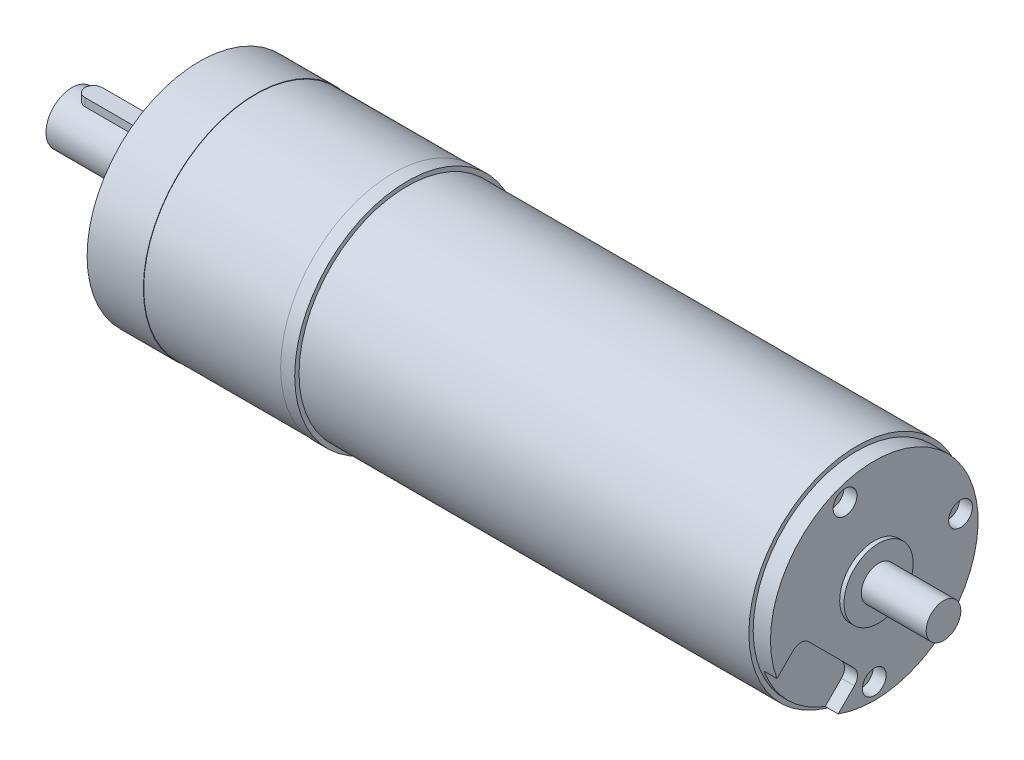
from build123d import *

# Parameters (mm, degrees)
BOSS_EXTRUDE1_DEPTH             = 1.5
BOSS_EXTRUDE1_DEPTH_BACK        = 1.5
SKETCH4_R                       = 3
CUT_EXTRUDE1_DEPTH              = 3.5
TAP_DRILL_FOR_M4X0_7_TAP1_D     = 3.3
TAP_DRILL_FOR_M4X0_7_TAP1_DEPTH = 10
TAP_DRILL_FOR_M4X0_7_TAP1_TIP   = 0.991420021
TAP_DRILL_FOR_M5X0_8_TAP1_D     = 4.2
TAP_DRILL_FOR_M5X0_8_TAP1_DEPTH = 10
TAP_DRILL_FOR_M5X0_8_TAP1_TIP   = 1.2618073
CUT_EXTRUDE2_DEPTH              = 3
FILLET1_R                       = 2.5
SKETCH12_R                      = 2.75
CUT_EXTRUDE3_DEPTH              = 3
TAP_DRILL_FOR_M3X0_5_TAP2_D     = 2.5
TAP_DRILL_FOR_M3X0_5_TAP2_DEPTH = 10
TAP_DRILL_FOR_M3X0_5_TAP2_TIP   = 0.751075774


with BuildPart() as part:
    # Sketch2 → Revolve1 (revolve)
    with BuildSketch(Plane(origin=(0, 0, 0), x_dir=(1, 0, 0), z_dir=(0, 1, 0))):
        Polygon((-77.5, 0), (-77.5, 6), (-51.5, 6), (-51.5, 16), (-48, 16), (-48, 26), (-35, 26), (-35, 25.9), (-3.25, 25.9), (-3.25, 26), (0, 26), (0, 25), (104, 25), (104, 24), (108, 24), (108, 8), (109, 8), (109, 4), (124, 4), (124, 0), align=None)
    revolve(axis=Axis((-131.1939937, 0, 0), (1, 0, 0)))

    # Sketch3 → Boss-Extrude1 (add, two sides: drawn at the far end of the back side and taken through both)
    with BuildSketch(Plane(origin=(0, 6, 0), x_dir=(1, 0, 0), z_dir=(0, 1, 0)).offset(-BOSS_EXTRUDE1_DEPTH_BACK)):
        with BuildLine():
            Line((-56.5, 2), (-72.5, 2))
            ThreePointArc((-72.5, 2), (-74.5, 0), (-72.5, -2))
            Line((-72.5, -2), (-56.5, -2))
            ThreePointArc((-56.5, -2), (-54.5, 0), (-56.5, 2))
        make_face()
    extrude(amount=BOSS_EXTRUDE1_DEPTH + BOSS_EXTRUDE1_DEPTH_BACK)

    # Sketch4 → Cut-Extrude1 (cut)
    with BuildSketch(Plane.ZY.offset(77.5)):
        Circle(SKETCH4_R)
    extrude(amount=-CUT_EXTRUDE1_DEPTH, mode=Mode.SUBTRACT)

    # Tap Drill for M4x0.7 Tap1
    with Locations(Plane.ZY.offset(74)):
        with Locations((0, 0)):
            Hole(TAP_DRILL_FOR_M4X0_7_TAP1_D / 2, depth=TAP_DRILL_FOR_M4X0_7_TAP1_DEPTH)
            with Locations((0, 0, -(TAP_DRILL_FOR_M4X0_7_TAP1_DEPTH + TAP_DRILL_FOR_M4X0_7_TAP1_TIP / 2))):  # 118° drill point
                Cone(0, TAP_DRILL_FOR_M4X0_7_TAP1_D / 2, TAP_DRILL_FOR_M4X0_7_TAP1_TIP, mode=Mode.SUBTRACT)

    # Tap Drill for M5x0.8 Tap1
    with Locations(Plane.ZY.offset(48)):
        with Locations((0, 22.5), (14.142135624, 14.142135624), (22.5, 0), (14.142135624, -14.142135624), (0, -22.5), (-14.142135624, -14.142135624), (-22.5, 0), (-14.142135624, 14.142135624)):
            Hole(TAP_DRILL_FOR_M5X0_8_TAP1_D / 2, depth=TAP_DRILL_FOR_M5X0_8_TAP1_DEPTH)
            with Locations((0, 0, -(TAP_DRILL_FOR_M5X0_8_TAP1_DEPTH + TAP_DRILL_FOR_M5X0_8_TAP1_TIP / 2))):  # 118° drill point
                Cone(0, TAP_DRILL_FOR_M5X0_8_TAP1_D / 2, TAP_DRILL_FOR_M5X0_8_TAP1_TIP, mode=Mode.SUBTRACT)

    # Sketch13 → Cut-Extrude2 (cut)
    with BuildSketch(Plane(origin=(108, 0, 0), x_dir=(0, 0, -1), z_dir=(1, 0, 0))):
        Polygon((-16.970562748, -2.828427125), (-25.455844123, -11.313708499), (-11.313708499, -25.455844123), (-2.828427125, -16.970562748), align=None)
    extrude(amount=-CUT_EXTRUDE2_DEPTH, mode=Mode.SUBTRACT)

    # Fillet1
    fillet1_edges = [part.edges().sort_by_distance(p)[0] for p in [
        (106.5, -16.970562748, 2.828427125),
        (106.5, -2.828427125, 16.970562748),
    ]]
    fillet(fillet1_edges, radius=FILLET1_R)

    # Sketch12 → Cut-Extrude3 (cut)
    with BuildSketch(Plane(origin=(108, 0, 0), x_dir=(0, 0, -1), z_dir=(1, 0, 0))):
        with Locations((-6.759588899, 19.088490195)):
            Circle(SKETCH12_R)
        with Locations((19.957510196, 3.429327453)):
            Circle(SKETCH12_R)
        with Locations((0, -20.25)):
            Circle(SKETCH12_R)
    extrude(amount=-CUT_EXTRUDE3_DEPTH, mode=Mode.SUBTRACT)

    # Tap Drill for M3x0.5 Tap2
    with Locations(Plane(origin=(105, 0, 0), x_dir=(0, 0, -1), z_dir=(1, 0, 0))):
        with Locations((-6.759588899, 19.088490195), (19.957510196, 3.429327453), (0, -20.25)):
            Hole(TAP_DRILL_FOR_M3X0_5_TAP2_D / 2, depth=TAP_DRILL_FOR_M3X0_5_TAP2_DEPTH)
            with Locations((0, 0, -(TAP_DRILL_FOR_M3X0_5_TAP2_DEPTH + TAP_DRILL_FOR_M3X0_5_TAP2_TIP / 2))):  # 118° drill point
                Cone(0, TAP_DRILL_FOR_M3X0_5_TAP2_D / 2, TAP_DRILL_FOR_M3X0_5_TAP2_TIP, mode=Mode.SUBTRACT)


solid = part.part
